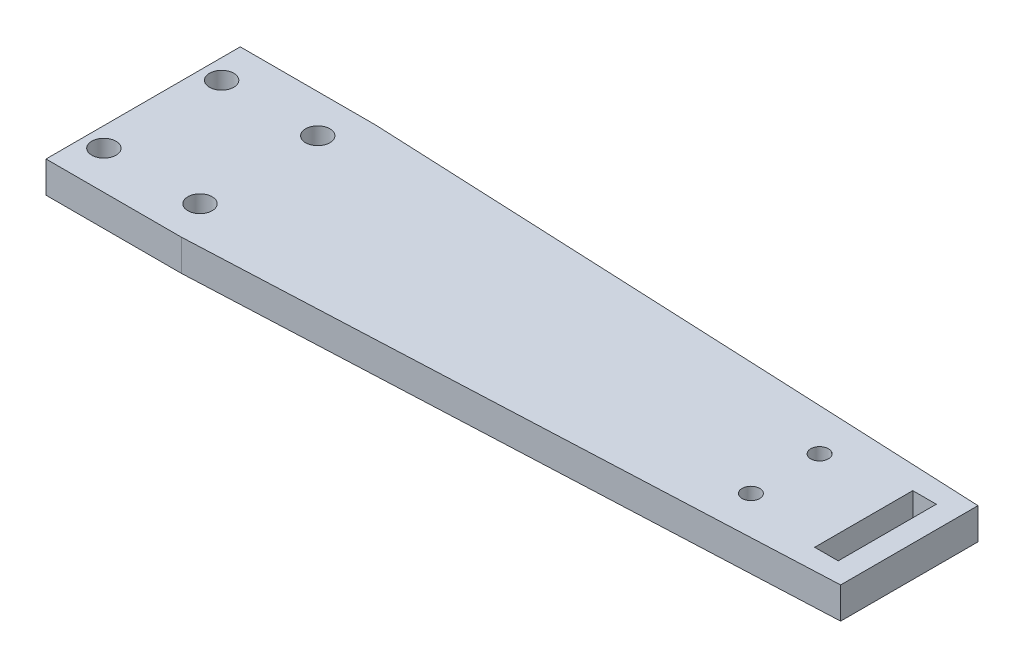
from build123d import *

# Parameters (mm, degrees)
SKETCH1_W           = 34.5
SKETCH1_H           = 49.5
BOSS_EXTRUDE1_DEPTH = 8
SKETCH2_R           = 3.1
CUT_EXTRUDE1_DEPTH  = 61.864603835
SKETCH3_W           = 6
SKETCH3_H           = 25
BOSS_EXTRUDE2_DEPTH = 8
FILLET1_R           = 10
FILLET2_R           = 5
BOSS_EXTRUDE3_DEPTH = 8
SKETCH8_R           = 2.25
CUT_EXTRUDE2_DEPTH  = 202.585744784


with BuildPart() as part:
    # Sketch1 → Boss-Extrude1 (new body)
    with BuildSketch(Plane(origin=(0, 0, 0), x_dir=(1, 0, 0), z_dir=(0, 1, 0))):
        with Locations((17.25, 24.75)):
            Rectangle(SKETCH1_W, SKETCH1_H)
    extrude(amount=BOSS_EXTRUDE1_DEPTH)

    # Sketch2 → Cut-Extrude1 (cut, through all)
    with BuildSketch(Plane(origin=(0, 8, 0), x_dir=(1, 0, 0), z_dir=(0, 1, 0))):
        with Locations(Location((5, 39.75, 0), (0, 0, 270))):
            Circle(SKETCH2_R)
        with Locations(Location((5, 9.75, 0), (0, 0, 90))):
            Circle(SKETCH2_R)
        with Locations(Location((29.5, 9.75, 0), (0, 0, 270))):
            Circle(SKETCH2_R)
        with Locations(Location((29.5, 39.75, 0), (0, 0, 90))):
            Circle(SKETCH2_R)
    extrude(amount=-CUT_EXTRUDE1_DEPTH, mode=Mode.SUBTRACT)

    # Sketch3 → Boss-Extrude2 (add, through all)
    with BuildSketch(Plane(origin=(0, 8, 0), x_dir=(1, 0, 0), z_dir=(0, 1, 0))):
        Polygon((195.25, 42.25), (34.5, 49.5), (34.5, 41.491867701), (89.599952536, 39.006799857), (89.599952536, 10.493200143), (34.5, 8.008132299), (34.5, 0), (195.25, 7.25), align=None)
        Polygon((176.564901879, 14.415414033), (94.599952536, 10.718705586), (94.599952536, 38.781294414), (176.564901879, 35.084585967), align=None, mode=Mode.SUBTRACT)
        with Locations((186.63, 24.75)):
            Rectangle(SKETCH3_W, SKETCH3_H, mode=Mode.SUBTRACT)
    extrude(amount=-BOSS_EXTRUDE2_DEPTH)

    # Fillet1
    fillet1_edges = [part.edges().sort_by_distance(p)[0] for p in [
        (34.5, 4, -8.008132299),
        (89.599952536, 4, -10.493200143),
        (89.599952536, 4, -39.006799857),
        (34.5, 4, -41.491867701),
        (94.599952536, 4, -38.781294414),
        (94.599952536, 4, -10.718705586),
    ]]
    fillet(fillet1_edges, radius=FILLET1_R)

    # Fillet2
    fillet2_edges = [part.edges().sort_by_distance(p)[0] for p in [
        (176.564901879, 4, -35.084585967),
        (176.564901879, 4, -14.415414033),
    ]]
    fillet(fillet2_edges, radius=FILLET2_R)

    # Sketch7 → Boss-Extrude3 (add, through all)
    with BuildSketch(Plane(origin=(0, 8, 0), x_dir=(1, 0, 0), z_dir=(0, 1, 0))):
        with BuildLine():
            Line((105.050505418, 11.190036898), (171.79017832, 14.200068802))
            ThreePointArc((171.79017832, 14.200068802), (175.179205561, 15.740022551), (176.564901879, 19.194991277))
            Line((176.564901879, 19.194991277), (176.564901879, 30.305008723))
            ThreePointArc((176.564901879, 30.305008723), (175.179205561, 33.759977449), (171.79017832, 35.299931198))
            Line((171.79017832, 35.299931198), (105.050505418, 38.309963102))
            ThreePointArc((105.050505418, 38.309963102), (97.690015084, 35.548725516), (94.599952536, 28.320118153))
            Line((94.599952536, 28.320118153), (94.599952536, 21.179881847))
            ThreePointArc((94.599952536, 21.179881847), (97.690015084, 13.951274484), (105.050505418, 11.190036898))
        make_face()
        with BuildLine():
            Line((89.599952536, 20.052354631), (89.599952536, 29.447645369))
            ThreePointArc((89.599952536, 29.447645369), (86.828559899, 36.357582821), (80.050505418, 39.437490318))
            Line((80.050505418, 39.437490318), (44.950552883, 41.020536389))
            ThreePointArc((44.950552883, 41.020536389), (37.590062548, 38.259298803), (34.5, 31.03069144))
            Line((34.5, 31.03069144), (34.5, 18.46930856))
            ThreePointArc((34.5, 18.46930856), (37.590062548, 11.240701197), (44.950552883, 8.479463611))
            Line((44.950552883, 8.479463611), (80.050505418, 10.062509682))
            ThreePointArc((80.050505418, 10.062509682), (86.828559899, 13.142417179), (89.599952536, 20.052354631))
        make_face()
    extrude(amount=-BOSS_EXTRUDE3_DEPTH)

    # Sketch8 → Cut-Extrude2 (cut, through all)
    with BuildSketch(Plane(origin=(0, 8, 0), x_dir=(1, 0, 0), z_dir=(0, 1, 0))):
        with Locations(Location((163.63, 33.5, 0), (0, 0, 270))):
            Circle(SKETCH8_R)
        with Locations(Location((163.63, 16, 0), (0, 0, 270))):
            Circle(SKETCH8_R)
    extrude(amount=-CUT_EXTRUDE2_DEPTH, mode=Mode.SUBTRACT)


solid = part.part
